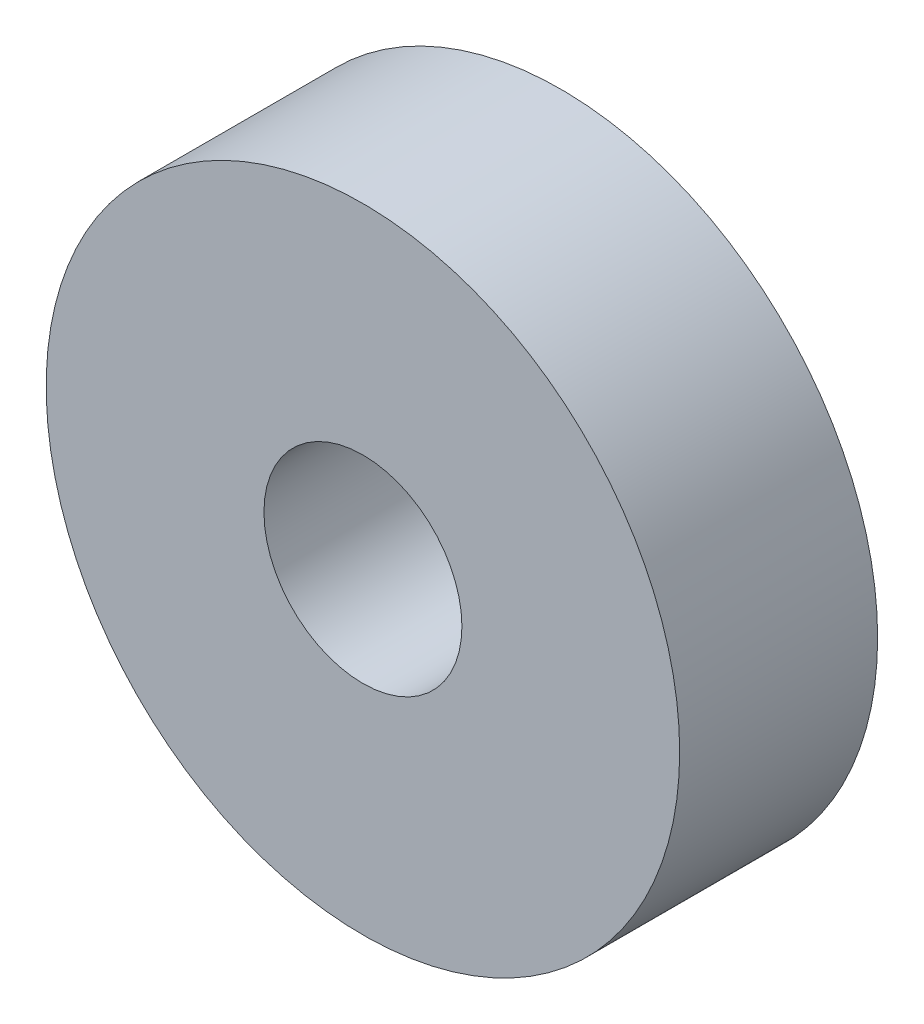
from build123d import *

# Parameters (mm, degrees)
SKETCH_1_R      = 8
SKETCH_1_R_2    = 2.5
EXTRUDE_1_DEPTH = 2.5


with BuildPart() as part:
    # Эскиз1 → Бобышка-Вытянуть1 (new, symmetric)
    with BuildSketch(Plane.XY):
        Circle(SKETCH_1_R)
        Circle(SKETCH_1_R_2, mode=Mode.SUBTRACT)
    extrude(amount=EXTRUDE_1_DEPTH, both=True)


solid = part.part
